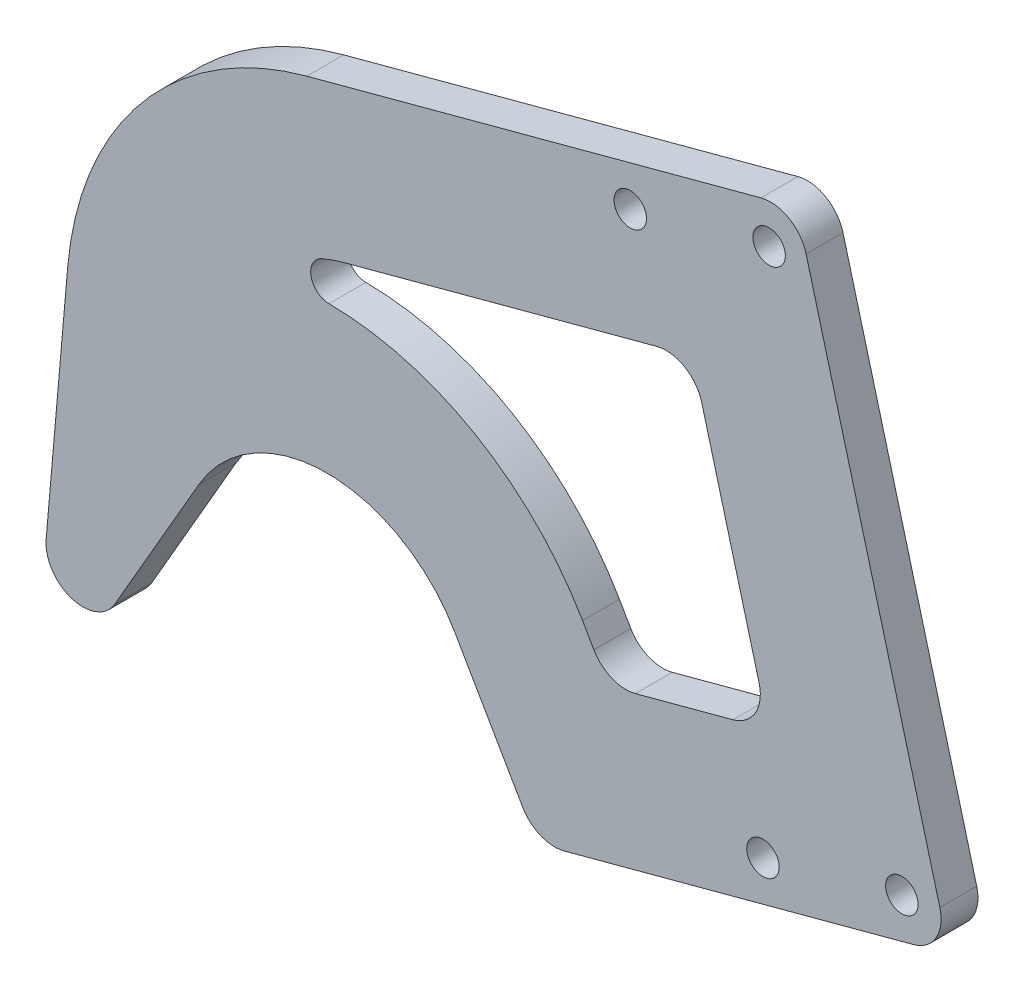
from build123d import *

# Parameters (mm, degrees)
BOSS_EXTRUDE1_DEPTH = 1.5875
CUT_EXTRUDE2_DEPTH  = 89.192108483
SKETCH6_R           = 1.397
CUT_EXTRUDE4_DEPTH  = 89.192108483
FILLET2_R           = 3.175
FILLET3_R           = 1.5875


with BuildPart() as part:
    # Sketch1 → Boss-Extrude1 (new, symmetric)
    with BuildSketch(Plane.XY):
        with BuildLine():
            Line((-10.998522628, 23.655866667), (-18.24043875, 11.1125))
            ThreePointArc((-18.24043875, 11.1125), (-21.94481032, 9.671948681), (-24.152987573, 12.976719483))
            Line((-24.152987573, 12.976719483), (-22.297752317, 34.18215549))
            ThreePointArc((-22.297752317, 34.18215549), (-15.875212752, 49.687537615), (-1.720654513, 58.704985723))
            Line((-1.720654513, 58.704985723), (40.411152545, 69.9941694))
            Line((40.411152545, 69.9941694), (53.559160036, 20.925137425))
            Line((53.559160036, 20.925137425), (20.419180992, 12.045306803))
            ThreePointArc((20.419180992, 12.045306803), (18.382410626, 12.178803785), (16.847799867, 13.524621301))
            Line((16.847799867, 13.524621301), (10.998522628, 23.655866667))
            ThreePointArc((10.998522628, 23.655866667), (0, 30.005866667), (-10.998522628, 23.655866667))
        make_face()
    extrude(amount=BOSS_EXTRUDE1_DEPTH, both=True)

    # Sketch3 → Cut-Extrude2 (cut, through all)
    with BuildSketch(Plane.XY.offset(1.5875)):
        with BuildLine():
            Line((24.191927715, 26.204218731), (38.004900169, 29.905393546))
            Line((38.004900169, 29.905393546), (31.430896424, 54.439909533))
            Line((31.430896424, 54.439909533), (1.566347359, 46.437727729))
            ThreePointArc((1.566347359, 46.437727729), (-2.362137074, 44.764405324), (-5.670491663, 42.064815035))
            ThreePointArc((-5.670491663, 42.064815035), (10.14857857, 40.590332583), (21.997045256, 30.005866667))
            Line((21.997045256, 30.005866667), (24.191927715, 26.204218731))
        make_face()
    extrude(amount=-CUT_EXTRUDE2_DEPTH, mode=Mode.SUBTRACT)

    # Sketch6 → Cut-Extrude4 (cut, through all)
    with BuildSketch(Plane(origin=(0, 0, -1.5875), x_dir=(-1, 0, 0), z_dir=(0, 0, -1))):
        with Locations((-37.520080405, 20.08540496)):
            Circle(SKETCH6_R)
        with Locations((-26.101035899, 62.701859231)):
            Circle(SKETCH6_R)
        with Locations((-38.049345185, 65.903399055)):
            Circle(SKETCH6_R)
        with Locations((-49.468389691, 23.286944784)):
            Circle(SKETCH6_R)
    extrude(amount=-CUT_EXTRUDE4_DEPTH, mode=Mode.SUBTRACT)

    # Fillet2
    fillet2_edges = [part.edges().sort_by_distance(p)[0] for p in [
        (40.411152545, 69.9941694, 0),
        (53.559160036, 20.925137425, 0),
        (31.430896424, 54.439909533, 0),
        (38.004900169, 29.905393546, 0),
        (24.191927715, 26.204218731, 0),
    ]]
    fillet(fillet2_edges, radius=FILLET2_R)

    # Fillet3
    fillet3_edges = [part.edges().sort_by_distance(p)[0] for p in [
        (-5.670491663, 42.064815035, 0),
    ]]
    fillet(fillet3_edges, radius=FILLET3_R)


solid = part.part
